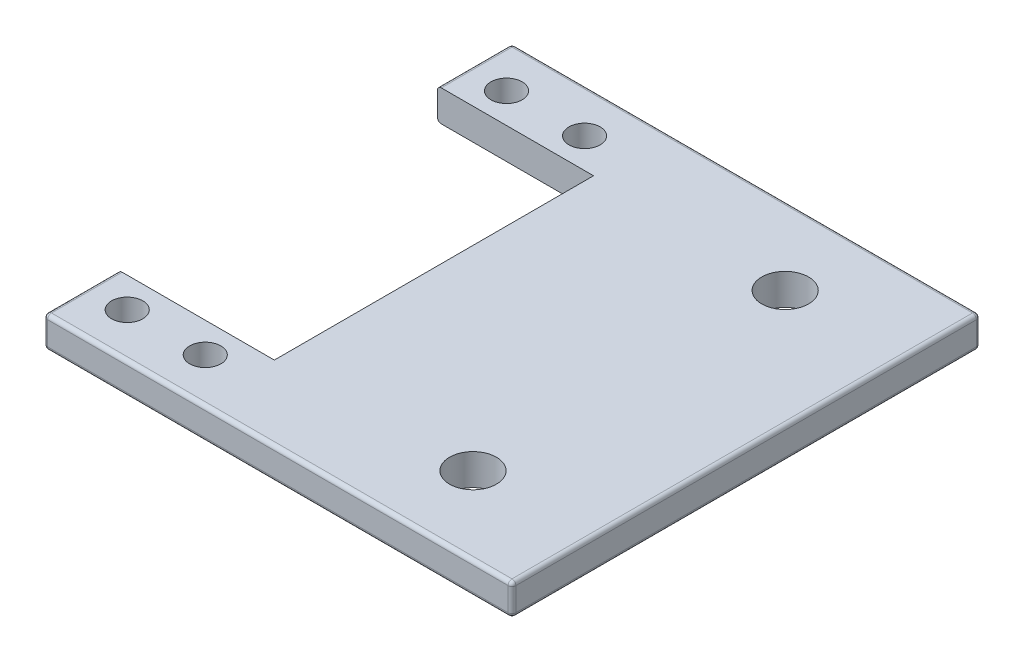
from build123d import *

# Parameters (mm, degrees)
SKETCH1_R           = 2
SKETCH1_R_2         = 3
BOSS_EXTRUDE1_DEPTH = 2
FILLET1_R           = 0.5


with BuildPart() as part:
    # Sketch1 → Boss-Extrude1 (new, symmetric)
    with BuildSketch(Plane(origin=(0, 0, 0), x_dir=(1, 0, 0), z_dir=(0, 1, 0))):
        Polygon((-30, -20.45), (-30, -30), (30, -30), (30, 30), (-30, 30), (-30, 20.45), (-10, 20.45), (-10, -20.45), align=None)
        with Locations((-25, -24.3)):
            Circle(SKETCH1_R, mode=Mode.SUBTRACT)
        with Locations((-15, -24.3)):
            Circle(SKETCH1_R, mode=Mode.SUBTRACT)
        with Locations((15, -20)):
            Circle(SKETCH1_R_2, mode=Mode.SUBTRACT)
        with Locations((-25, 24.3)):
            Circle(SKETCH1_R, mode=Mode.SUBTRACT)
        with Locations((-15, 24.3)):
            Circle(SKETCH1_R, mode=Mode.SUBTRACT)
        with Locations((15, 20)):
            Circle(SKETCH1_R_2, mode=Mode.SUBTRACT)
    extrude(amount=BOSS_EXTRUDE1_DEPTH, both=True)

    # Fillet1
    fillet1_edges = [part.edges().sort_by_distance(p)[0] for p in [
        (30, 2, 0),
        (30, -2, 0),
        (-30, 0, 30),
        (0, 2, 30),
        (30, 0, 30),
        (0, -2, 30),
        (30, 0, -30),
        (0, 2, -30),
        (-30, 0, -30),
        (0, -2, -30),
        (-30, -2, 25.225),
        (-30, 2, 25.225),
        (-30, -2, -25.225),
        (-30, 2, -25.225),
    ]]
    fillet(fillet1_edges, radius=FILLET1_R)


solid = part.part
